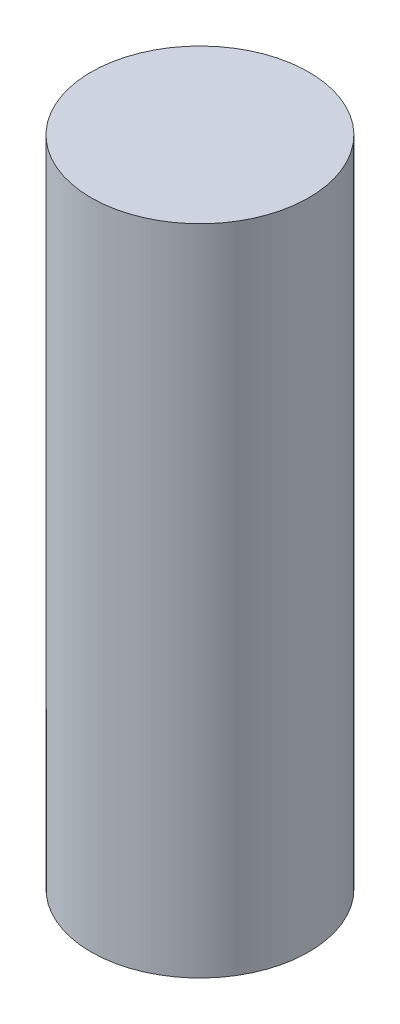
from build123d import *

# Parameters (mm, degrees)
SKETCH1_R           = 25
BOSS_EXTRUDE1_DEPTH = 150


with BuildPart() as part:
    # Sketch1 → Boss-Extrude1 (new body)
    with BuildSketch(Plane(origin=(0, 0, 0), x_dir=(1, 0, 0), z_dir=(0, 1, 0))):
        with Locations(Location((0, 0, 0), (0, 0, 270))):
            Circle(SKETCH1_R)
    extrude(amount=BOSS_EXTRUDE1_DEPTH)


solid = part.part
